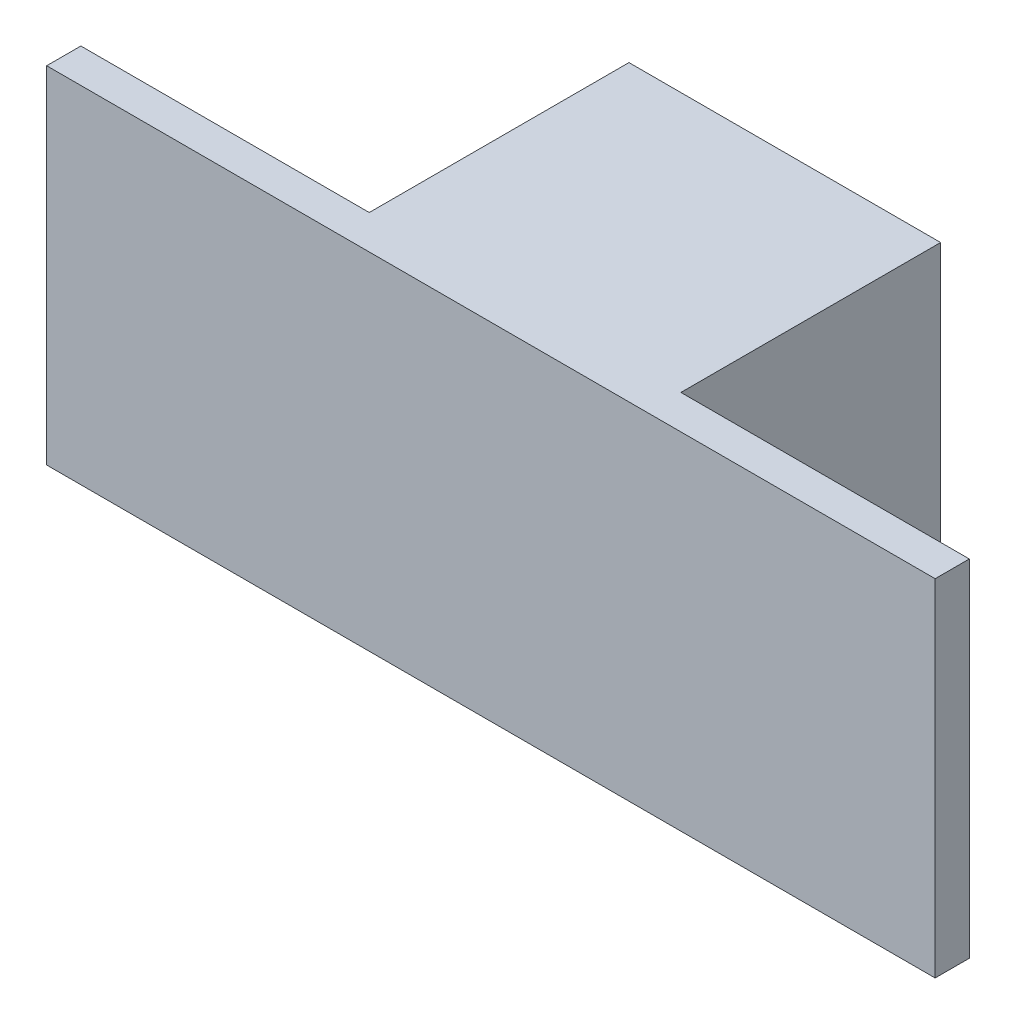
from build123d import *

# Parameters (mm, degrees)
SKETCH1_W           = 130
SKETCH1_H           = 50.6
BOSS_EXTRUDE1_DEPTH = 5
SKETCH2_W           = 45.6
SKETCH2_H           = 50.6
BOSS_EXTRUDE2_DEPTH = 38


with BuildPart() as part:
    # Sketch1 → Boss-Extrude1 (new body)
    with BuildSketch(Plane.XY):
        with Locations((0, -13.3)):
            Rectangle(SKETCH1_W, SKETCH1_H)
    extrude(amount=-BOSS_EXTRUDE1_DEPTH)

    # Sketch2 → Boss-Extrude2 (add)
    with BuildSketch(Plane(origin=(0, 0, -5), x_dir=(-1, 0, 0), z_dir=(0, 0, -1))):
        with Locations((0, -13.3)):
            Rectangle(SKETCH2_W, SKETCH2_H)
    extrude(amount=BOSS_EXTRUDE2_DEPTH)


solid = part.part
